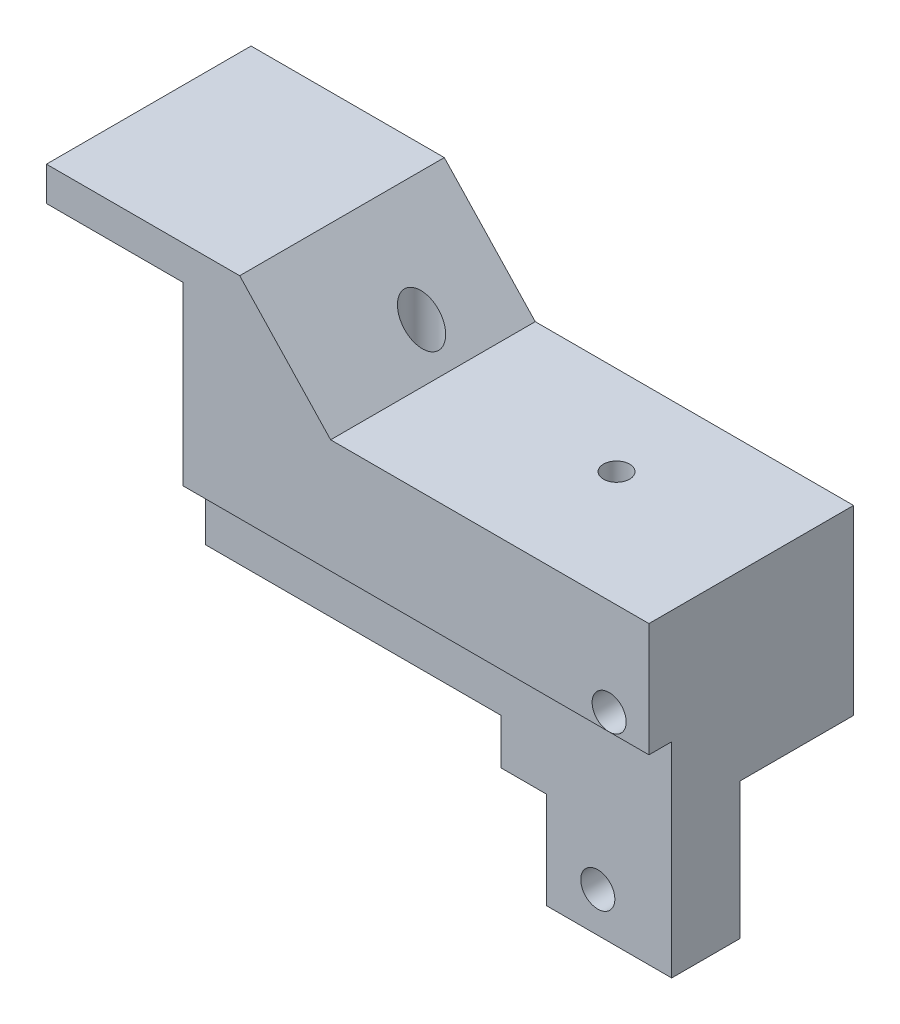
from build123d import *

# Parameters (mm, degrees)
SKETCH1_W           = 41
SKETCH1_H           = 28
BOSS_EXTRUDE1_DEPTH = 18
CUT_EXTRUDE1_DEPTH  = 18
BOSS_EXTRUDE2_DEPTH = 18
SKETCH4_W           = 41
SKETCH4_H           = 18
CUT_EXTRUDE2_DEPTH  = 2
SKETCH5_R           = 1.5
CUT_EXTRUDE9_DEPTH  = 11
SKETCH6_R           = 1.5
CUT_EXTRUDE10_DEPTH = 43.64387412
SKETCH7_R           = 2.5
CUT_EXTRUDE11_DEPTH = 7
SKETCH8_W           = 11
SKETCH8_H           = 12
CUT_EXTRUDE12_DEPTH = 10
SKETCH9_R           = 5
CUT_EXTRUDE13_DEPTH = 4
SKETCH10_R          = 1.5
CUT_EXTRUDE14_DEPTH = 43.1930089
SKETCH11_R          = 1.15
CUT_EXTRUDE15_DEPTH = 47.521500406


with BuildPart() as part:
    # Sketch1 → Boss-Extrude1 (new body)
    with BuildSketch(Plane.XY):
        Rectangle(SKETCH1_W, SKETCH1_H)
    extrude(amount=BOSS_EXTRUDE1_DEPTH)

    # Sketch2 → Cut-Extrude1 (cut)
    with BuildSketch(Plane.XY.offset(18)):
        Polygon((9.5, -14), (9.5, -5.5), (5.5, -5.5), (5.5, -1.5), (-20.5, -1.5), (-20.5, -14), align=None)
    extrude(amount=-CUT_EXTRUDE1_DEPTH, mode=Mode.SUBTRACT)

    # Sketch3 → Boss-Extrude2 (add)
    with BuildSketch(Plane.XY.offset(18)):
        Polygon((-20.5, 22.5), (-32.5, 22.5), (-32.5, 19.5), (-20.5, 19.5), (-20.5, 14), (-7.5, 14), (-15.5, 22.5), align=None)
    extrude(amount=-BOSS_EXTRUDE2_DEPTH)

    # Sketch4 → Cut-Extrude2 (cut)
    with BuildSketch(Plane.XY.offset(18)):
        with Locations((0, -5)):
            Rectangle(SKETCH4_W, SKETCH4_H)
    extrude(amount=-CUT_EXTRUDE2_DEPTH, mode=Mode.SUBTRACT)

    # Sketch5 → Cut-Extrude9 (cut)
    with BuildSketch(Plane.XY.offset(18)):
        with Locations((17, 5.501)):
            Circle(SKETCH5_R)
    extrude(amount=-CUT_EXTRUDE9_DEPTH, mode=Mode.SUBTRACT)

    # Sketch6 → Cut-Extrude10 (cut, through all)
    with BuildSketch(Plane.XY.offset(16)):
        with Locations((14, -10.5)):
            Circle(SKETCH6_R)
    extrude(amount=-CUT_EXTRUDE10_DEPTH, mode=Mode.SUBTRACT)

    # Sketch7 → Cut-Extrude11 (cut)
    with BuildSketch(Plane(origin=(0, 0, 0), x_dir=(-1, 0, 0), z_dir=(0, 0, -1))):
        with Locations((-17, 5.501)):
            Circle(SKETCH7_R)
    extrude(amount=-CUT_EXTRUDE11_DEPTH, mode=Mode.SUBTRACT)

    # Sketch8 → Cut-Extrude12 (cut)
    with BuildSketch(Plane(origin=(0, 0, 0), x_dir=(-1, 0, 0), z_dir=(0, 0, -1))):
        with Locations((-15, -8)):
            Rectangle(SKETCH8_W, SKETCH8_H)
    extrude(amount=-CUT_EXTRUDE12_DEPTH, mode=Mode.SUBTRACT)

    # Sketch9 → Cut-Extrude13 (cut)
    with BuildSketch(Plane.XZ.offset(1.5)):
        with Locations((-10, 7.5)):
            Circle(SKETCH9_R)
    extrude(amount=-CUT_EXTRUDE13_DEPTH, mode=Mode.SUBTRACT)

    # Sketch10 → Cut-Extrude14 (cut, through all)
    with BuildSketch(Plane.XZ.offset(-2.5)):
        with Locations((-10, 7.5)):
            Circle(SKETCH10_R)
    extrude(amount=-CUT_EXTRUDE14_DEPTH, mode=Mode.SUBTRACT)

    # Sketch11 → Cut-Extrude15 (cut, through all)
    with BuildSketch(Plane.XZ.offset(5.5)):
        with Locations((7.5, 7.85)):
            Circle(SKETCH11_R)
    extrude(amount=-CUT_EXTRUDE15_DEPTH, mode=Mode.SUBTRACT)


solid = part.part
